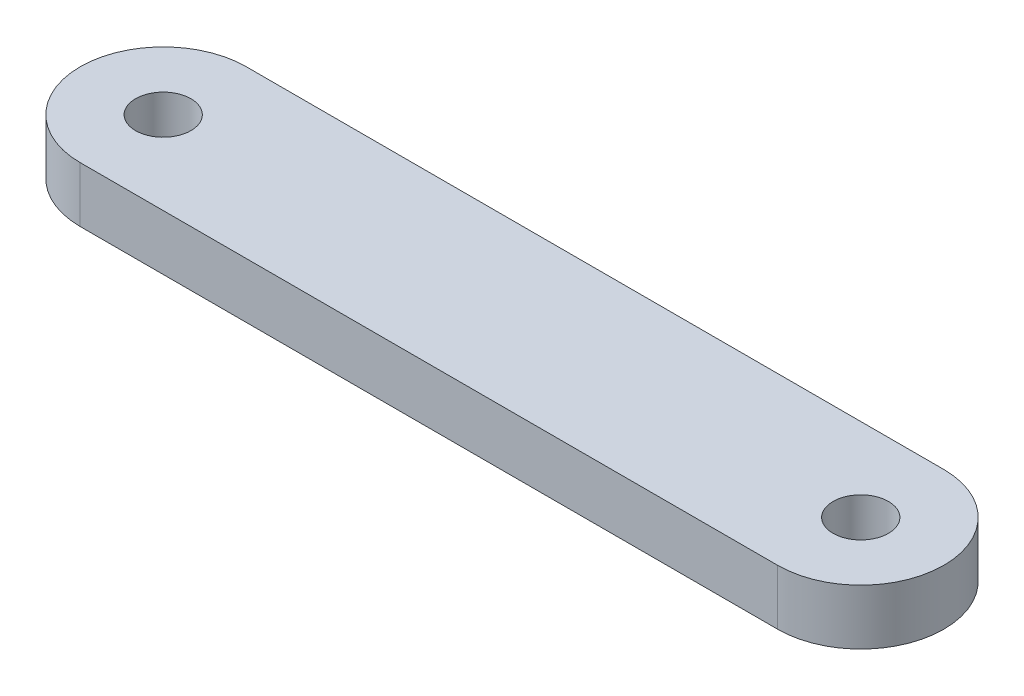
from build123d import *

# Parameters (mm, degrees)
CROQUIS1_R              = 1.5875
SALIENTE_EXTRUIR1_DEPTH = 3.175


with BuildPart() as part:
    # Croquis1 → Saliente-Extruir1 (new body)
    with BuildSketch(Plane(origin=(0, 0, 0), x_dir=(1, 0, 0), z_dir=(0, 1, 0))):
        with BuildLine():
            Line((-20, 0), (20, 0))
            ThreePointArc((20, 0), (24.7625, -4.7625), (20, -9.525))
            Line((20, -9.525), (-20, -9.525))
            ThreePointArc((-20, -9.525), (-24.7625, -4.7625), (-20, 0))
        make_face()
        with Locations(Location((-20, -4.7625, 0), (0, 0, 270))):
            Circle(CROQUIS1_R, mode=Mode.SUBTRACT)
        with Locations(Location((20, -4.7625, 0), (0, 0, 270))):
            Circle(CROQUIS1_R, mode=Mode.SUBTRACT)
    extrude(amount=SALIENTE_EXTRUIR1_DEPTH)


solid = part.part
